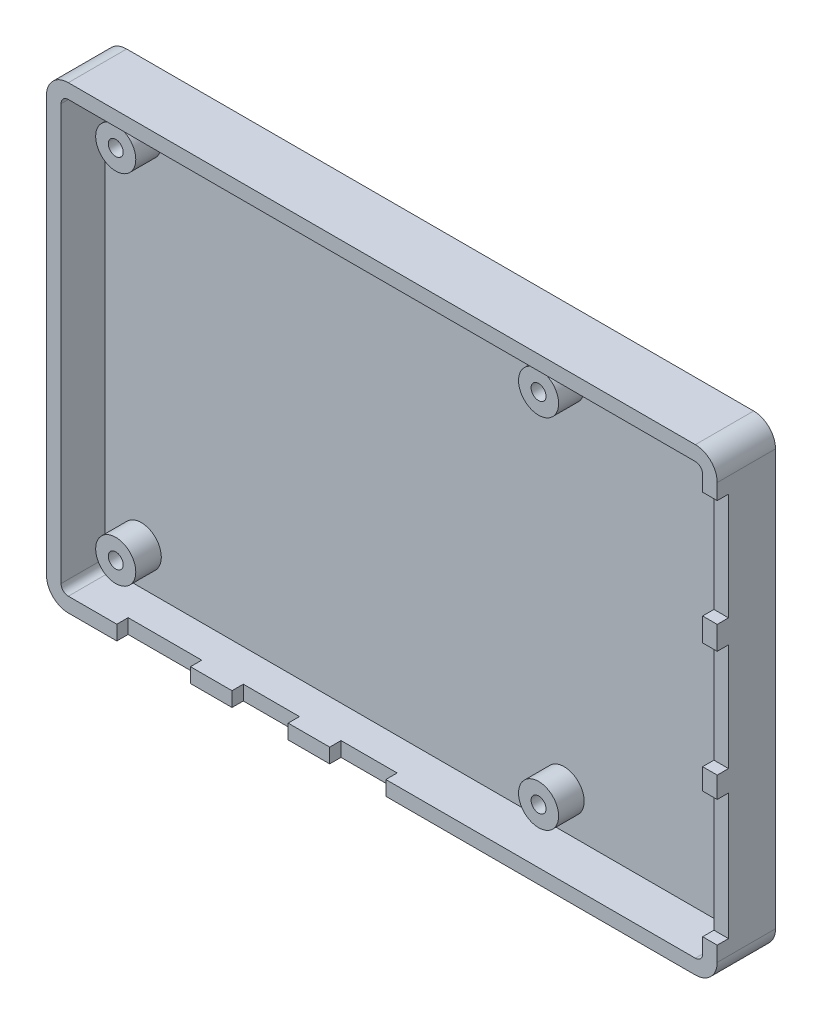
from build123d import *

# Parameters (mm, degrees)
CASEENVELOPE_W                       = 92
CASEENVELOPE_H                       = 63
BOTTOM_ENVELOPE_DEPTH                = 8
OUTSIDE_R3_R                         = 3
SHELL_1_T                            = -2
SIDEPORT_CLEARANCE_1_START           = 6.45
SIDEPORT_PROFILE_1_W                 = 10.1
SIDEPORT_PROFILE_1_H                 = 13
SIDEPORT_CLEARANCE_1_DEPTH           = 4.5
SIDEPORT_CLEARANCE_2_START           = 6.45
SIDEPORT_PROFILE_2_W                 = 7.7
SIDEPORT_PROFILE_2_H                 = 13
SIDEPORT_CLEARANCE_2_DEPTH           = 4.7
SIDEPORT_CLEARANCE_3_START           = 6.45
SIDEPORT_PROFILE_3_W                 = 7.7
SIDEPORT_PROFILE_3_H                 = 13
SIDEPORT_CLEARANCE_3_DEPTH           = 4.7
ENDPORT_CLEARANCE_1_START            = 6.45
ENDPORT_PROFILE_1_W                  = 11
ENDPORT_PROFILE_1_H                  = 17.3
ENDPORT_CLEARANCE_1_DEPTH            = 14.6
ENDPORT_CLEARANCE_2_START            = 6.45
ENDPORT_PROFILE_2_W                  = 11
ENDPORT_PROFILE_2_H                  = 14.7
ENDPORT_CLEARANCE_2_DEPTH            = 16.3
ENDPORT_CLEARANCE_3_START            = 6.45
ENDPORT_PROFILE_3_W                  = 11
ENDPORT_PROFILE_3_H                  = 14.7
ENDPORT_CLEARANCE_3_DEPTH            = 16.3
FOUR_M2P5_STANDOFFS_2P05_PILOT_START = 2
STANDOFF_RINGS_R                     = 2.75
STANDOFF_RINGS_R_2                   = 1.025
FOUR_M2P5_STANDOFFS_2P05_PILOT_DEPTH = 3.5


with BuildPart() as part:
    # CaseEnvelope → Bottom_Envelope (new body)
    with BuildSketch(Plane.XY):
        Rectangle(CASEENVELOPE_W, CASEENVELOPE_H)
    extrude(amount=BOTTOM_ENVELOPE_DEPTH)

    # Outside_R3
    outside_r3_edges = [part.edges().sort_by_distance(p)[0] for p in [
        (46, -31.5, 4),
        (-46, -31.5, 4),
        (-46, 31.5, 4),
        (46, 31.5, 4),
    ]]
    fillet(outside_r3_edges, radius=OUTSIDE_R3_R)

    # 抽壳1
    shell_1_openings = [part.faces().sort_by_distance(p)[0] for p in [
        (0, 0, 8),
    ]]
    offset(amount=SHELL_1_T, openings=shell_1_openings, kind=Kind.INTERSECTION)

    # SidePort_Profile_1 → SidePort_Clearance_1 (cut)
    with BuildSketch(Plane.XY.offset(SIDEPORT_CLEARANCE_1_START)):
        with Locations((-31.3, -33.5)):
            Rectangle(SIDEPORT_PROFILE_1_W, SIDEPORT_PROFILE_1_H)
    extrude(amount=SIDEPORT_CLEARANCE_1_DEPTH, mode=Mode.SUBTRACT)

    # SidePort_Profile_2 → SidePort_Clearance_2 (cut)
    with BuildSketch(Plane.XY.offset(SIDEPORT_CLEARANCE_2_START)):
        with Locations((-16.7, -33.5)):
            Rectangle(SIDEPORT_PROFILE_2_W, SIDEPORT_PROFILE_2_H)
    extrude(amount=SIDEPORT_CLEARANCE_2_DEPTH, mode=Mode.SUBTRACT)

    # SidePort_Profile_3 → SidePort_Clearance_3 (cut)
    with BuildSketch(Plane.XY.offset(SIDEPORT_CLEARANCE_3_START)):
        with Locations((-3.3, -33.5)):
            Rectangle(SIDEPORT_PROFILE_3_W, SIDEPORT_PROFILE_3_H)
    extrude(amount=SIDEPORT_CLEARANCE_3_DEPTH, mode=Mode.SUBTRACT)

    # EndPort_Profile_1 → EndPort_Clearance_1 (cut)
    with BuildSketch(Plane.XY.offset(ENDPORT_CLEARANCE_1_START)):
        with Locations((47.5, -17.8)):
            Rectangle(ENDPORT_PROFILE_1_W, ENDPORT_PROFILE_1_H)
    extrude(amount=ENDPORT_CLEARANCE_1_DEPTH, mode=Mode.SUBTRACT)

    # EndPort_Profile_2 → EndPort_Clearance_2 (cut)
    with BuildSketch(Plane.XY.offset(ENDPORT_CLEARANCE_2_START)):
        with Locations((47.5, 1.1)):
            Rectangle(ENDPORT_PROFILE_2_W, ENDPORT_PROFILE_2_H)
    extrude(amount=ENDPORT_CLEARANCE_2_DEPTH, mode=Mode.SUBTRACT)

    # EndPort_Profile_3 → EndPort_Clearance_3 (cut)
    with BuildSketch(Plane.XY.offset(ENDPORT_CLEARANCE_3_START)):
        with Locations((47.5, 19)):
            Rectangle(ENDPORT_PROFILE_3_W, ENDPORT_PROFILE_3_H)
    extrude(amount=ENDPORT_CLEARANCE_3_DEPTH, mode=Mode.SUBTRACT)

    # Standoff_Rings → Four_M2p5_Standoffs_2p05_Pilot (add)
    # profile 1 of 4: a face of its own
    with BuildSketch(Plane.XY.offset(FOUR_M2P5_STANDOFFS_2P05_PILOT_START)):
        with Locations(Location((-39, -24.5, 0), (0, 0, 180))):
            Circle(STANDOFF_RINGS_R)
        with Locations((-39, -24.5)):
            Circle(STANDOFF_RINGS_R_2, mode=Mode.SUBTRACT)
    # profile 2 of 4: a face of its own
    with BuildSketch(Plane.XY.offset(FOUR_M2P5_STANDOFFS_2P05_PILOT_START)):
        with Locations(Location((-39, 24.5, 0), (0, 0, 180))):
            Circle(STANDOFF_RINGS_R)
        with Locations((-39, 24.5)):
            Circle(STANDOFF_RINGS_R_2, mode=Mode.SUBTRACT)
    # profile 3 of 4: a face of its own
    with BuildSketch(Plane.XY.offset(FOUR_M2P5_STANDOFFS_2P05_PILOT_START)):
        with Locations(Location((19, -24.5, 0), (0, 0, 180))):
            Circle(STANDOFF_RINGS_R)
        with Locations((19, -24.5)):
            Circle(STANDOFF_RINGS_R_2, mode=Mode.SUBTRACT)
    # profile 4 of 4: a face of its own
    with BuildSketch(Plane.XY.offset(FOUR_M2P5_STANDOFFS_2P05_PILOT_START)):
        with Locations(Location((19, 24.5, 0), (0, 0, 180))):
            Circle(STANDOFF_RINGS_R)
        with Locations((19, 24.5)):
            Circle(STANDOFF_RINGS_R_2, mode=Mode.SUBTRACT)
    extrude(amount=FOUR_M2P5_STANDOFFS_2P05_PILOT_DEPTH)


solid = part.part
